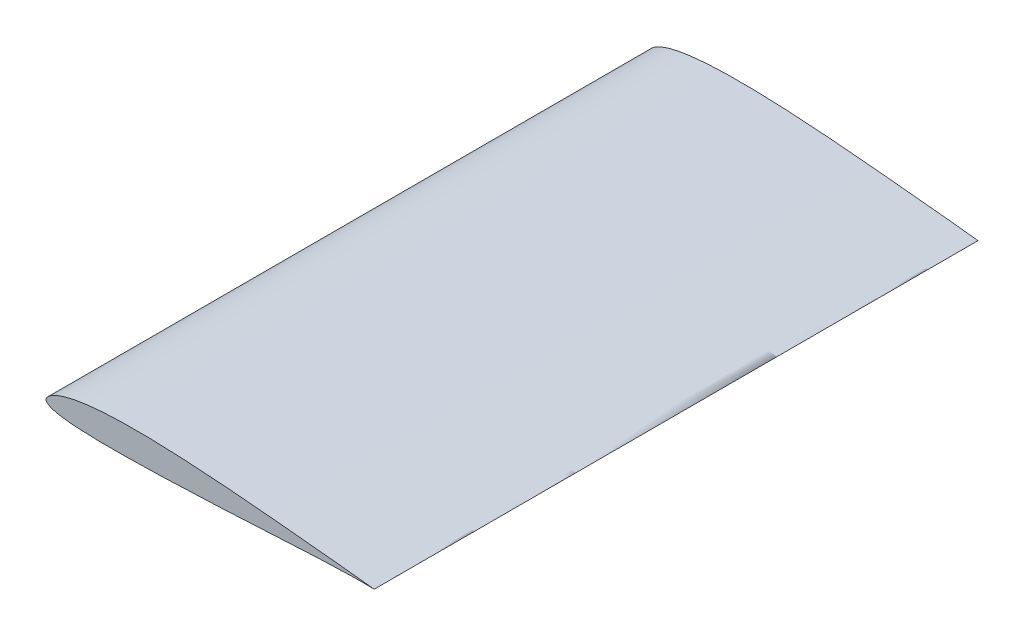
from build123d import *

# Parameters (mm, degrees)
BOSS_EXTRUDE1_DEPTH = 230
SKETCH5_W           = 15.2
SKETCH5_H           = 2.2
CUT_EXTRUDE1_DEPTH  = 220


with BuildPart() as part:
    # Sketch1 → Boss-Extrude1 (new body)
    with BuildSketch(Plane.XY):
        with BuildLine():
            add(Edge.make_bspline(
                [(125, 0), (125.000051844, 0.004063726), (124.156806783, 0.075518032), (123.306301537, 0.18292661), (121.271537217, 0.419893677), (118.798426643, 0.71296151), (115.590288608, 1.057545782), (111.815042283, 1.448295607), (107.472282638, 1.891912657), (102.63337082, 2.378220686), (97.356931028, 2.904268835), (91.710485562, 3.45304998), (85.765697734, 4.021030711), (79.595796026, 4.587063983), (73.273367099, 5.135212666), (66.870425484, 5.647643221), (60.456730328, 6.105162744), (54.102781021, 6.499862806), (47.875019339, 6.807984594), (41.837057715, 7.021223055), (36.047353834, 7.122856903), (30.560060777, 7.106241807), (25.424968458, 6.963129008), (20.68611862, 6.689563205), (16.38165352, 6.287458046), (12.542652878, 5.755848239), (9.194207046, 5.103590414), (6.351832114, 4.343564812), (4.026713349, 3.488988776), (2.218596956, 2.578484099), (0.931834888, 1.635477439), (0.141510244, 0.760580189), (-0.119731906, -0.25815916), (0.681576767, -1.047941613), (1.881485405, -1.668698041), (3.716463758, -2.24752402), (6.134085658, -2.69444653), (9.15772567, -3.049500289), (12.762364149, -3.316781701), (16.918136914, -3.495871413), (21.584094337, -3.590635389), (26.71516699, -3.602194363), (32.260081615, -3.540562054), (38.159864012, -3.415267667), (44.349147355, -3.235739832), (50.758483828, -3.012875481), (57.315327815, -2.751658805), (63.94588626, -2.457839307), (70.576106741, -2.140076887), (77.13377034, -1.802054278), (83.550306384, -1.449784851), (89.757054615, -1.099742796), (95.682213492, -0.777183277), (101.248745255, -0.497077189), (106.378648906, -0.269828362), (111.004035499, -0.097243039), (115.040857141, 0.016302157), (118.47720587, 0.070770994), (121.113380675, 0.083044235), (123.258942213, 0.048343814), (124.140686302, 0.036145887), (124.999948045, -0.00407242), (125, 0)],
                knots=[0, 0, 0, 0, 0.001582942, 0.006232619, 0.013742047, 0.02389505, 0.036583059, 0.051672893, 0.068988889, 0.088287828, 0.109326481, 0.131834637, 0.155528852, 0.180107798, 0.205270561, 0.230746378, 0.256240763, 0.281481346, 0.306200469, 0.330143645, 0.353088144, 0.374829533, 0.395176841, 0.413968092, 0.43108074, 0.446404501, 0.459885545, 0.471489829, 0.481241102, 0.48919602, 0.495419125, 0.500009029, 0.503131826, 0.506605442, 0.512016533, 0.51946178, 0.529149773, 0.541186766, 0.55550726, 0.571990101, 0.590480648, 0.610819264, 0.632803736, 0.656204678, 0.680761481, 0.706192777, 0.732217138, 0.758538062, 0.78485863, 0.810892118, 0.836366001, 0.861025394, 0.884574426, 0.906699141, 0.927082414, 0.945448143, 0.961520643, 0.975064943, 0.985841725, 0.993665619, 0.998413672, 1, 1, 1, 1], degree=3))
        make_face()
    extrude(amount=BOSS_EXTRUDE1_DEPTH)

    # Sketch5 → Cut-Extrude1 (cut)
    with BuildSketch(Plane(origin=(0, 0, 0), x_dir=(-1, 0, 0), z_dir=(0, 0, -1))):
        with Locations((-48.346705191, 1.526431024)):
            Rectangle(SKETCH5_W, SKETCH5_H)
    extrude(amount=-CUT_EXTRUDE1_DEPTH, mode=Mode.SUBTRACT)


solid = part.part
